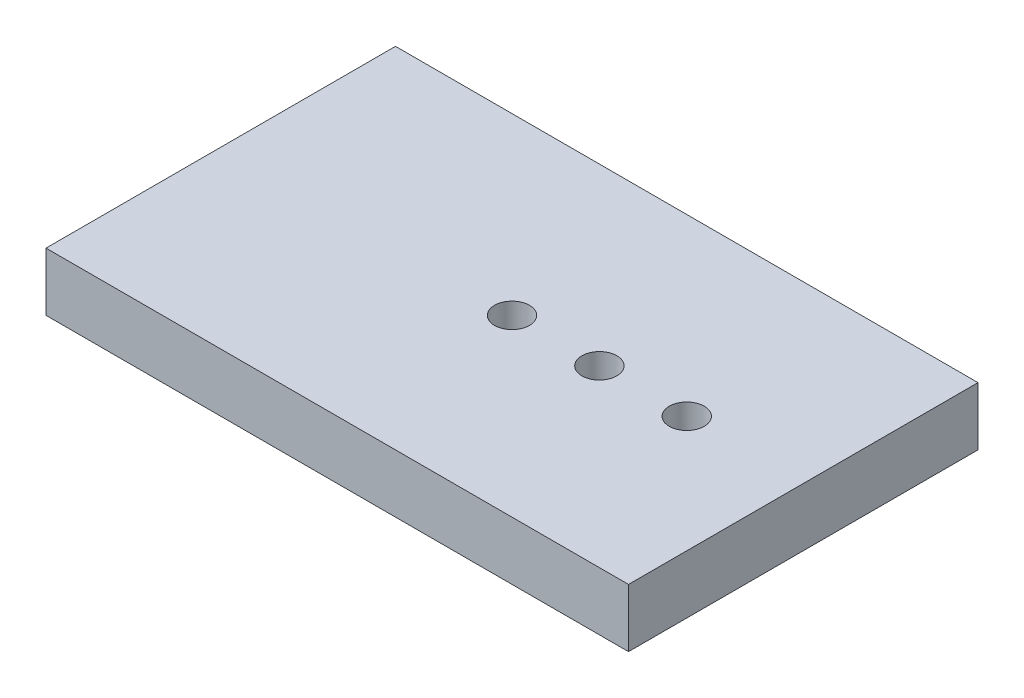
from build123d import *

# Parameters (mm, degrees)
SKETCH_1_W             = 100
SKETCH_1_H             = 60
EXTRUDE_1_DEPTH        = 10
SKETCH_2_R             = 3
CUT_EXTRUDE_1_DEPTH    = 20
PATTERN_LINEAR_1_COUNT = 3
PATTERN_LINEAR_1_PITCH = 15


with BuildPart() as part:
    # 草图1 → 凸台-拉伸1 (new body)
    with BuildSketch(Plane(origin=(0, 0, 0), x_dir=(1, 0, 0), z_dir=(0, 1, 0))):
        Rectangle(SKETCH_1_W, SKETCH_1_H)
    extrude(amount=EXTRUDE_1_DEPTH)

    # 草图2 → 切除-拉伸1 (cut)
    with BuildSketch(Plane(origin=(0, 0, 0), x_dir=(1, 0, 0), z_dir=(0, 1, 0))):
        with Locations(Location((30, 0, 0), (0, 0, 90))):
            Circle(SKETCH_2_R)
    cut_extrude_1 = extrude(amount=CUT_EXTRUDE_1_DEPTH, mode=Mode.SUBTRACT)

    # 阵列(线性)1: 切除-拉伸1 ×3
    with Locations(*[(-i * PATTERN_LINEAR_1_PITCH, 0, 0) for i in range(1, PATTERN_LINEAR_1_COUNT)]):
        add(cut_extrude_1, mode=Mode.SUBTRACT)


solid = part.part
